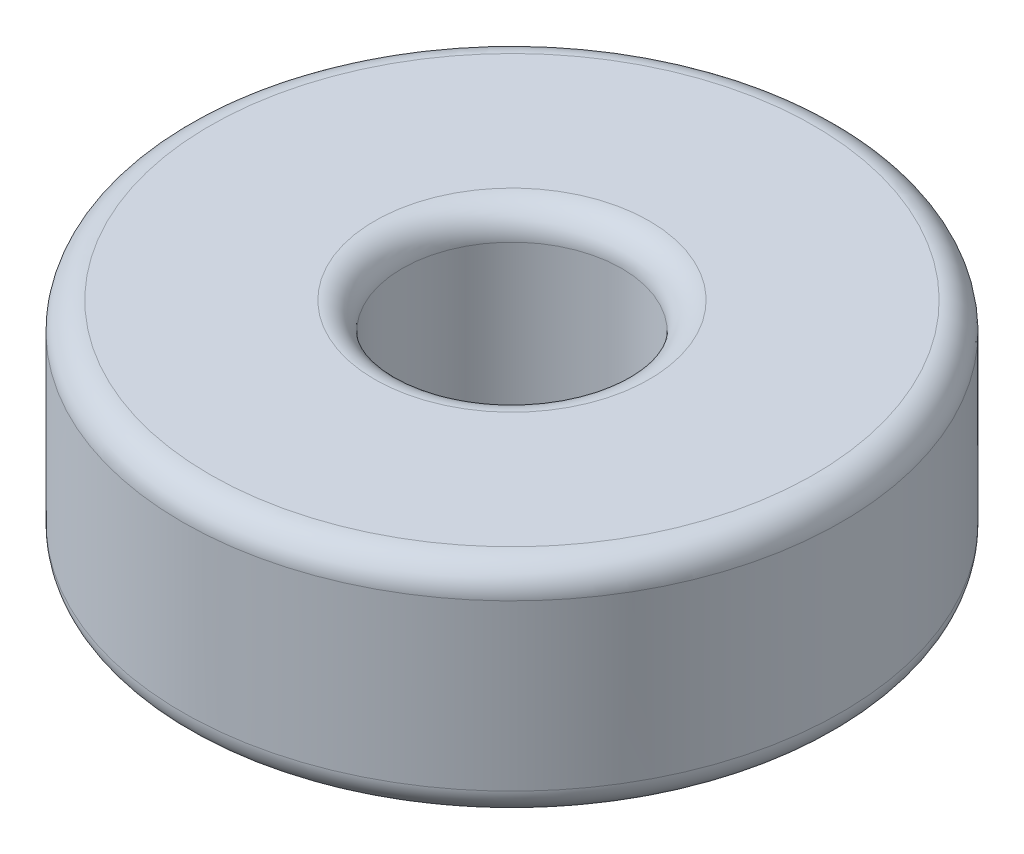
from build123d import *

# Parameters (mm, degrees)
ESQUISSE1_W = 4
ESQUISSE1_H = 4
CONG_1_R    = 0.5


with BuildPart() as part:
    # Esquisse1 → Révolution1 (revolve)
    with BuildSketch(Plane.XY, mode=Mode.PRIVATE) as r_volution1_sk:
        with Locations((4, 2)):
            Rectangle(ESQUISSE1_W, ESQUISSE1_H)
    revolve(r_volution1_sk.sketch.rotate(Axis((0, 0, 0), (0, 1, 0)), 90), axis=Axis((0, 0, 0), (0, 1, 0)))

    # Congé1
    cong_1_edges = [part.edges().sort_by_distance(p)[0] for p in [
        (0, 0, 2),
        (0, 0, 6),
        (0, 4, 6),
        (0, 4, 2),
    ]]
    fillet(cong_1_edges, radius=CONG_1_R)


solid = part.part
